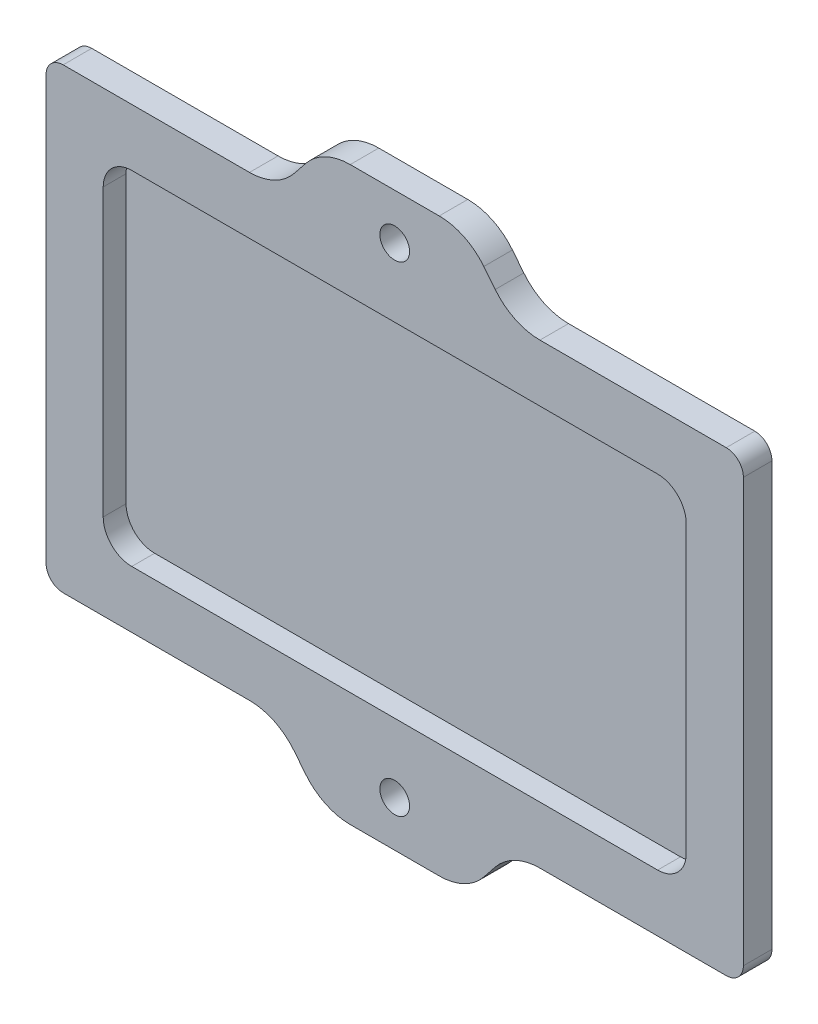
from build123d import *

# Parameters (mm, degrees)
BOSS_EXTRUDE1_DEPTH  = 5
CUT_EXTRUDE1_START   = -10
SKETCH3_R            = 2.6
CUT_EXTRUDE1_DEPTH   = 10
FILLET1_R            = 10
FILLET2_R            = 3
SKETCH4_R            = 2.6
CUT_EXTRUDE2_DEPTH   = 10
CUT_EXTRUDE3_DEPTH   = 4
CUT_EXTRUDE4_DEPTH   = 83.286086309
MIRROR2_COPY_1_DEPTH = 83.286086309


with BuildPart() as part:
    # Sketch1 → Boss-Extrude1 (new body)
    with BuildSketch(Plane.XY):
        with BuildLine():
            Line((-58, 55), (58, 55))
            ThreePointArc((58, 55), (60.121320344, 54.121320344), (61, 52))
            Line((61, 52), (61, -52))
            ThreePointArc((61, -52), (60.121320344, -54.121320344), (58, -55))
            Line((58, -55), (-58, -55))
            ThreePointArc((-58, -55), (-60.121320344, -54.121320344), (-61, -52))
            Line((-61, -52), (-61, 52))
            ThreePointArc((-61, 52), (-60.121320344, 54.121320344), (-58, 55))
        make_face()
    extrude(amount=BOSS_EXTRUDE1_DEPTH)

    # Sketch3 → Cut-Extrude1 (cut)
    with BuildSketch(Plane.XY.offset(5).offset(CUT_EXTRUDE1_START)):
        with BuildLine():
            Line((-58, 55), (-8.6, 55))
            Line((-8.6, 55), (-8.6, 59.373865289))
            Line((-8.6, 59.373865289), (-61, 59.373865289))
            Line((-61, 59.373865289), (-61, 52))
            ThreePointArc((-61, 52), (-60.121320344, 54.121320344), (-58, 55))
        make_face()
        with BuildLine():
            Line((-17.597879381, 43.752948644), (-8.6, 55))
            Line((-8.6, 55), (-58, 55))
            ThreePointArc((-58, 55), (-60.121320344, 54.121320344), (-61, 52))
            Line((-61, 52), (-61, 40))
            Line((-61, 40), (-25.40648677, 40))
            ThreePointArc((-25.40648677, 40), (-21.074657685, 40.986939655), (-17.597879381, 43.752948644))
        make_face()
        with BuildLine():
            ThreePointArc((58, 55), (60.121320344, 54.121320344), (61, 52))
            Line((61, 52), (61, 59.373865289))
            Line((61, 59.373865289), (8.6, 59.373865289))
            Line((8.6, 59.373865289), (8.6, 55))
            Line((8.6, 55), (13.480832282, 55))
            Line((13.480832282, 55), (58, 55))
        make_face()
        with BuildLine():
            ThreePointArc((17.597879381, 43.752948644), (21.074657685, 40.986939655), (25.40648677, 40))
            Line((25.40648677, 40), (61, 40))
            Line((61, 40), (61, 52))
            ThreePointArc((61, 52), (60.121320344, 54.121320344), (58, 55))
            Line((58, 55), (13.480832282, 55))
            Line((13.480832282, 55), (8.6, 55))
            Line((8.6, 55), (17.597879381, 43.752948644))
        make_face()
        with BuildLine():
            Line((61, -52), (61, -40))
            Line((61, -40), (25.40648677, -40))
            ThreePointArc((25.40648677, -40), (21.074657685, -40.986939655), (17.597879381, -43.752948644))
            Line((17.597879381, -43.752948644), (8.6, -55))
            Line((8.6, -55), (58, -55))
            ThreePointArc((58, -55), (60.121320344, -54.121320344), (61, -52))
        make_face()
        with BuildLine():
            Line((61, -59.373865289), (61, -52))
            ThreePointArc((61, -52), (60.121320344, -54.121320344), (58, -55))
            Line((58, -55), (8.6, -55))
            Line((8.6, -55), (8.6, -59.373865289))
            Line((8.6, -59.373865289), (61, -59.373865289))
        make_face()
        with BuildLine():
            Line((-58, -55), (-8.6, -55))
            Line((-8.6, -55), (-17.597879381, -43.752948644))
            ThreePointArc((-17.597879381, -43.752948644), (-21.074657685, -40.986939655), (-25.40648677, -40))
            Line((-25.40648677, -40), (-61, -40))
            Line((-61, -40), (-61, -52))
            ThreePointArc((-61, -52), (-60.121320344, -54.121320344), (-58, -55))
        make_face()
        with BuildLine():
            Line((-8.6, -59.373865289), (-8.6, -55))
            Line((-8.6, -55), (-58, -55))
            ThreePointArc((-58, -55), (-60.121320344, -54.121320344), (-61, -52))
            Line((-61, -52), (-61, -59.373865289))
            Line((-61, -59.373865289), (-8.6, -59.373865289))
        make_face()
        with Locations((0, -42)):
            Circle(SKETCH3_R)
    extrude(amount=CUT_EXTRUDE1_DEPTH, mode=Mode.SUBTRACT)

    # Fillet1
    fillet1_edges = [part.edges().sort_by_distance(p)[0] for p in [
        (-8.6, 55, 2.5),
        (8.6, 55, 2.5),
        (8.6, -55, 2.5),
        (-8.6, -55, 2.5),
    ]]
    fillet(fillet1_edges, radius=FILLET1_R)

    # Fillet2
    fillet2_edges = [part.edges().sort_by_distance(p)[0] for p in [
        (-61, -40, 2.5),
        (-61, 40, 2.5),
        (61, 40, 2.5),
        (61, -40, 2.5),
    ]]
    fillet(fillet2_edges, radius=FILLET2_R)

    # Sketch4 → Cut-Extrude2 (cut)
    with BuildSketch(Plane.XY.offset(5)):
        with Locations((0, 42)):
            Circle(SKETCH4_R)
    extrude(amount=-CUT_EXTRUDE2_DEPTH, mode=Mode.SUBTRACT)

    # Sketch5 → Cut-Extrude3 (cut)
    with BuildSketch(Plane.XY.offset(5)):
        with BuildLine():
            Line((-46, 30), (46, 30))
            ThreePointArc((46, 30), (49.535533906, 28.535533906), (51, 25))
            Line((51, 25), (51, -25))
            ThreePointArc((51, -25), (49.535533906, -28.535533906), (46, -30))
            Line((46, -30), (-46, -30))
            ThreePointArc((-46, -30), (-49.535533906, -28.535533906), (-51, -25))
            Line((-51, -25), (-51, 25))
            ThreePointArc((-51, 25), (-49.535533906, 28.535533906), (-46, 30))
        make_face()
    extrude(amount=-CUT_EXTRUDE3_DEPTH, mode=Mode.SUBTRACT)

    # Sketch6 → Cut-Extrude4 (cut, through all)
    with BuildSketch(Plane(origin=(0, 0, 0), x_dir=(-1, 0, 0), z_dir=(0, 0, -1))):
        with BuildLine():
            Line((0, 50), (-7.785066229, 50))
            ThreePointArc((-7.785066229, 50), (-12.116895314, 49.013060345), (-15.593673618, 46.247051356))
            Line((-15.593673618, 46.247051356), (-17.583467028, 43.759875465))
            ThreePointArc((-17.583467028, 43.759875465), (-21.066662425, 40.988761251), (-25.40648677, 40))
            Line((-25.40648677, 40), (-25.40648677, 70))
            Line((-25.40648677, 70), (0, 70))
            Line((0, 70), (0, 50))
        make_face()
    cut_extrude4 = extrude(amount=-CUT_EXTRUDE4_DEPTH, mode=Mode.SUBTRACT)

    # Mirror1: Cut-Extrude4 across plane
    add(cut_extrude4.mirror(Plane(origin=(0, 0, 0), x_dir=(0, 0, 1), z_dir=(1, 0, 0))), mode=Mode.SUBTRACT)

    # Mirror2: Cut-Extrude4 across plane
    add(cut_extrude4.mirror(Plane.ZX), mode=Mode.SUBTRACT)

    # Mirror2 copy 1 sketch → Mirror2 copy 1 (cut, through all)
    with BuildSketch(Plane(origin=(0, 0, 0), x_dir=(1, 0, 0), z_dir=(0, 0, -1))):
        with BuildLine():
            Line((0, 50), (-7.785066229, 50))
            ThreePointArc((-7.785066229, 50), (-12.116895314, 49.013060345), (-15.593673618, 46.247051356))
            Line((-15.593673618, 46.247051356), (-17.583467028, 43.759875465))
            ThreePointArc((-17.583467028, 43.759875465), (-21.066662425, 40.988761251), (-25.40648677, 40))
            Line((-25.40648677, 40), (-25.40648677, 70))
            Line((-25.40648677, 70), (0, 70))
            Line((0, 70), (0, 50))
        make_face()
    extrude(amount=-MIRROR2_COPY_1_DEPTH, mode=Mode.SUBTRACT)


solid = part.part
